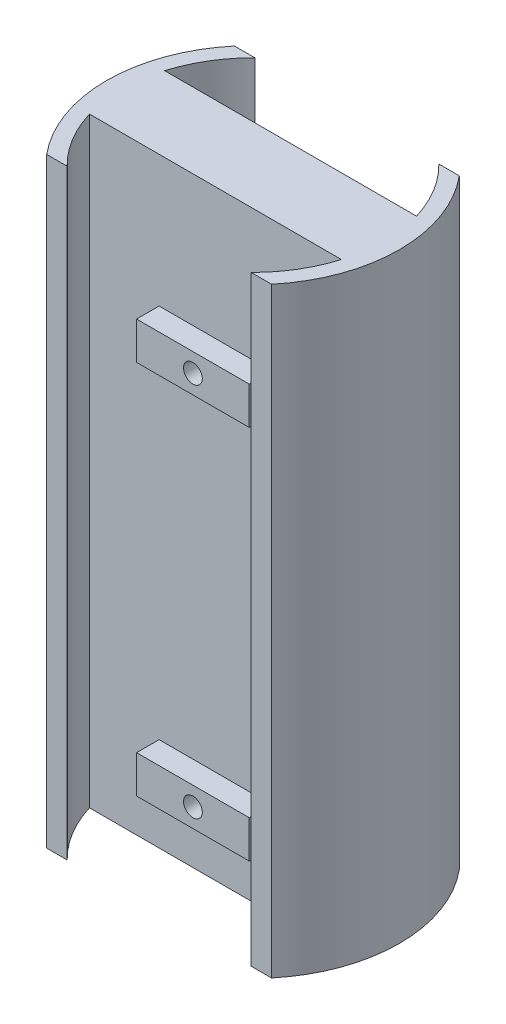
from build123d import *

# Parameters (mm, degrees)
SKETCH1_W           = 99.06
SKETCH1_H           = 203.2
BOSS_EXTRUDE1_DEPTH = 25.4
SKETCH2_R           = 49.53
SKETCH2_R_2         = 44.45
BOSS_EXTRUDE2_DEPTH = 203.2
CUT_EXTRUDE1_DEPTH  = 219.2109846
SKETCH6_W           = 38.1
SKETCH6_H           = 12.7
SKETCH6_R           = 3.175
BOSS_EXTRUDE3_DEPTH = 7.62


with BuildPart() as part:
    # Sketch1 → Boss-Extrude1 (new body)
    with BuildSketch(Plane.XY):
        Rectangle(SKETCH1_W, SKETCH1_H)
    extrude(amount=BOSS_EXTRUDE1_DEPTH)

    # Sketch2 → Boss-Extrude2 (add, through all)
    with BuildSketch(Plane(origin=(0, 101.6, 0), x_dir=(1, 0, 0), z_dir=(0, 1, 0))):
        with Locations((0, -12.7)):
            Circle(SKETCH2_R)
        with Locations((0, -12.7)):
            Circle(SKETCH2_R_2, mode=Mode.SUBTRACT)
    extrude(amount=-BOSS_EXTRUDE2_DEPTH)

    # Sketch3 → Cut-Extrude1 (cut, through all)
    with BuildSketch(Plane(origin=(0, 101.6, 0), x_dir=(1, 0, 0), z_dir=(0, 1, 0))):
        with BuildLine():
            Line((-38.01523905, 19.05), (-47.519048812, 19.05))
            ThreePointArc((-47.519048812, 19.05), (-57.15, -12.7), (-47.519048812, -44.45))
            Line((-47.519048812, -44.45), (-38.01523905, -44.45))
            ThreePointArc((-38.01523905, -44.45), (-43.988304304, -35.465104533), (-47.874115135, -25.4))
            Line((-47.874115135, -25.4), (-49.53, -25.4))
            Line((-49.53, -25.4), (-49.53, -12.7))
            Line((-49.53, -12.7), (-49.53, 0))
            Line((-49.53, 0), (-47.874115135, 0))
            ThreePointArc((-47.874115135, 0), (-43.988304304, 10.065104533), (-38.01523905, 19.05))
        make_face()
        with BuildLine():
            Line((47.519048812, 19.05), (38.01523905, 19.05))
            ThreePointArc((38.01523905, 19.05), (43.988304304, 10.065104533), (47.874115135, 0))
            Line((47.874115135, 0), (49.53, 0))
            Line((49.53, 0), (49.53, -12.7))
            Line((49.53, -12.7), (49.53, -25.4))
            Line((49.53, -25.4), (47.874115135, -25.4))
            ThreePointArc((47.874115135, -25.4), (43.988304304, -35.465104533), (38.01523905, -44.45))
            Line((38.01523905, -44.45), (47.519048812, -44.45))
            ThreePointArc((47.519048812, -44.45), (54.689286609, -29.289286609), (57.15, -12.7))
            ThreePointArc((57.15, -12.7), (54.689286609, 3.889286609), (47.519048812, 19.05))
        make_face()
        with BuildLine():
            ThreePointArc((31.108519733, 19.05), (0, 31.75), (-31.108519733, 19.05))
            Line((-31.108519733, 19.05), (31.108519733, 19.05))
        make_face()
        with BuildLine():
            ThreePointArc((38.01523905, 19.05), (0, 36.83), (-38.01523905, 19.05))
            Line((-38.01523905, 19.05), (-31.108519733, 19.05))
            ThreePointArc((-31.108519733, 19.05), (0, 31.75), (31.108519733, 19.05))
            Line((31.108519733, 19.05), (38.01523905, 19.05))
        make_face()
        with BuildLine():
            ThreePointArc((2.76e-07, 44.45), (-26.940768242, 37.701562541), (-47.519048812, 19.05))
            Line((-47.519048812, 19.05), (-38.01523905, 19.05))
            ThreePointArc((-38.01523905, 19.05), (0, 36.83), (38.01523905, 19.05))
            Line((38.01523905, 19.05), (47.519048812, 19.05))
            ThreePointArc((47.519048812, 19.05), (26.940768485, 37.701562411), (2.76e-07, 44.45))
        make_face()
        with BuildLine():
            Line((-63.5, 44.45), (-63.5, 19.05))
            Line((-63.5, 19.05), (-47.519048812, 19.05))
            ThreePointArc((-47.519048812, 19.05), (-26.940768242, 37.701562541), (2.76e-07, 44.45))
            Line((2.76e-07, 44.45), (-63.5, 44.45))
        make_face()
        with BuildLine():
            Line((63.5, 44.45), (2.76e-07, 44.45))
            ThreePointArc((2.76e-07, 44.45), (26.940768485, 37.701562411), (47.519048812, 19.05))
            Line((47.519048812, 19.05), (63.5, 19.05))
            Line((63.5, 19.05), (63.5, 44.45))
        make_face()
        with BuildLine():
            ThreePointArc((47.519048812, -44.45), (26.940768401, -63.101562456), (8.5e-08, -69.85))
            Line((8.5e-08, -69.85), (63.5, -69.85))
            Line((63.5, -69.85), (63.5, -44.45))
            Line((63.5, -44.45), (47.519048812, -44.45))
        make_face()
        with BuildLine():
            ThreePointArc((8.5e-08, -69.85), (-26.940768326, -63.101562496), (-47.519048812, -44.45))
            Line((-47.519048812, -44.45), (-63.5, -44.45))
            Line((-63.5, -44.45), (-63.5, -69.85))
            Line((-63.5, -69.85), (8.5e-08, -69.85))
        make_face()
        with BuildLine():
            Line((-38.01523905, -44.45), (-47.519048812, -44.45))
            ThreePointArc((-47.519048812, -44.45), (-26.940768326, -63.101562496), (8.5e-08, -69.85))
            ThreePointArc((8.5e-08, -69.85), (26.940768401, -63.101562456), (47.519048812, -44.45))
            Line((47.519048812, -44.45), (38.01523905, -44.45))
            ThreePointArc((38.01523905, -44.45), (0, -62.23), (-38.01523905, -44.45))
        make_face()
        with BuildLine():
            Line((-31.108519733, -44.45), (-38.01523905, -44.45))
            ThreePointArc((-38.01523905, -44.45), (0, -62.23), (38.01523905, -44.45))
            Line((38.01523905, -44.45), (31.108519733, -44.45))
            ThreePointArc((31.108519733, -44.45), (0, -57.15), (-31.108519733, -44.45))
        make_face()
        with BuildLine():
            Line((31.108519733, -44.45), (-31.108519733, -44.45))
            ThreePointArc((-31.108519733, -44.45), (0, -57.15), (31.108519733, -44.45))
        make_face()
        with BuildLine():
            ThreePointArc((-49.53, -12.7), (-49.114284188, -6.296251983), (-47.874115135, 0))
            Line((-47.874115135, 0), (-49.53, 0))
            Line((-49.53, 0), (-49.53, -12.7))
        make_face()
        with BuildLine():
            ThreePointArc((-47.874115135, -25.4), (-49.114284188, -19.103748017), (-49.53, -12.7))
            Line((-49.53, -12.7), (-49.53, -25.4))
            Line((-49.53, -25.4), (-47.874115135, -25.4))
        make_face()
        with BuildLine():
            Line((49.53, -25.4), (49.53, -12.7))
            ThreePointArc((49.53, -12.7), (49.114284188, -19.103748017), (47.874115135, -25.4))
            Line((47.874115135, -25.4), (49.53, -25.4))
        make_face()
        with BuildLine():
            Line((49.53, 0), (47.874115135, 0))
            ThreePointArc((47.874115135, 0), (49.114284188, -6.296251983), (49.53, -12.7))
            Line((49.53, -12.7), (49.53, 0))
        make_face()
    extrude(amount=-CUT_EXTRUDE1_DEPTH, mode=Mode.SUBTRACT)

    # Sketch6 → Boss-Extrude3 (add)
    # profile 1 of 2: a face of its own
    with BuildSketch(Plane.XY.offset(25.4)):
        with Locations((0, 50.8)):
            Rectangle(SKETCH6_W, SKETCH6_H)
        with Locations(Location((0, 50.8, 0), (0, 0, 180))):
            Circle(SKETCH6_R, mode=Mode.SUBTRACT)
    # profile 2 of 2: a face of its own
    with BuildSketch(Plane.XY.offset(25.4)):
        with Locations((0, -76.2)):
            Rectangle(SKETCH6_W, SKETCH6_H)
        with Locations(Location((0, -76.2, 0), (0, 0, 180))):
            Circle(SKETCH6_R, mode=Mode.SUBTRACT)
    extrude(amount=BOSS_EXTRUDE3_DEPTH)


solid = part.part
